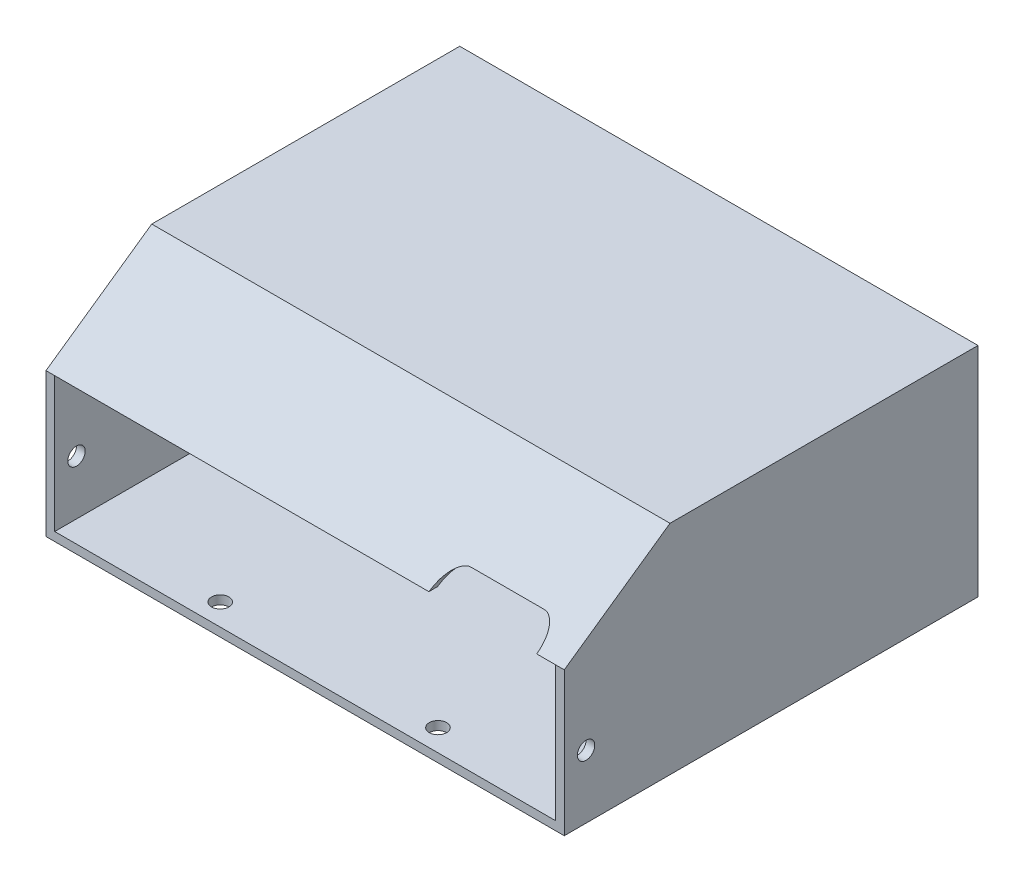
from build123d import *

# Parameters (mm, degrees)
SKETCH1_W               = 119
SKETCH1_H               = 50
BOSS_EXTRUDE1_DEPTH     = 95
SKETCH2_W               = 115
SKETCH2_H               = 46
CUT_EXTRUDE1_DEPTH      = 92
SKETCH3_W               = 50
SKETCH3_H               = 29
CUT_EXTRUDE2_DEPTH      = 10
SKETCH4_R               = 1.95
CUT_EXTRUDE3_DEPTH      = 10
SKETCH5_R               = 3.25
SKETCH5_R_2             = 1.95
BOSS_EXTRUDE3_DEPTH     = 10
FILLET1_R               = 2
SKETCH6_R               = 2
CUT_EXTRUDE4_DEPTH      = 10
CUT_EXTRUDE5_DEPTH      = 159.789168456
CUT_EXTRUDE5_DEPTH_BACK = 159.789168456
SKETCH8_R               = 2
BOSS_EXTRUDE4_DEPTH     = 115
CUT_EXTRUDE6_DEPTH      = 159.789168456
CUT_EXTRUDE6_DEPTH_BACK = 159.789168456
CUT_EXTRUDE8_DEPTH      = 10
CUT_EXTRUDE9_DEPTH      = 155.550962524


with BuildPart() as part:
    # Sketch1 → Boss-Extrude1 (new body)
    with BuildSketch(Plane.XY):
        with Locations((59.5, 25)):
            Rectangle(SKETCH1_W, SKETCH1_H)
    extrude(amount=BOSS_EXTRUDE1_DEPTH)

    # Sketch2 → Cut-Extrude1 (cut)
    with BuildSketch(Plane.XY.offset(95)):
        with Locations((59.5, 25)):
            Rectangle(SKETCH2_W, SKETCH2_H)
    extrude(amount=-CUT_EXTRUDE1_DEPTH, mode=Mode.SUBTRACT)

    # Sketch3 → Cut-Extrude2 (cut)
    with BuildSketch(Plane.XY.offset(3)):
        with Locations((33, 25)):
            Rectangle(SKETCH3_W, SKETCH3_H)
    extrude(amount=-CUT_EXTRUDE2_DEPTH, mode=Mode.SUBTRACT)

    # Sketch4 → Cut-Extrude3 (cut)
    with BuildSketch(Plane(origin=(0, 0, 0), x_dir=(-1, 0, 0), z_dir=(0, 0, -1))):
        with Locations((-32.95, 45)):
            Circle(SKETCH4_R)
        with Locations((-32.95, 5)):
            Circle(SKETCH4_R)
    extrude(amount=-CUT_EXTRUDE3_DEPTH, mode=Mode.SUBTRACT)

    # Sketch5 → Boss-Extrude3 (add)
    # profile 1 of 2: a face of its own
    with BuildSketch(Plane.XY.offset(3)):
        with Locations((32.95, 45)):
            Circle(SKETCH5_R)
        with Locations(Location((32.95, 45, 0), (0, 0, 180))):
            Circle(SKETCH5_R_2, mode=Mode.SUBTRACT)
    # profile 2 of 2: a face of its own
    with BuildSketch(Plane.XY.offset(3)):
        with Locations((32.95, 5)):
            Circle(SKETCH5_R)
        with Locations(Location((32.95, 5, 0), (0, 0, 180))):
            Circle(SKETCH5_R_2, mode=Mode.SUBTRACT)
    extrude(amount=BOSS_EXTRUDE3_DEPTH)

    # Fillet1
    fillet1_edges = [part.edges().sort_by_distance(p)[0] for p in [
        (31.147224362, 42.295836543, 3),
        (31.147224362, 7.704163457, 3),
    ]]
    fillet(fillet1_edges, radius=FILLET1_R)

    # Sketch6 → Cut-Extrude4 (cut)
    with BuildSketch(Plane(origin=(0, 2, 0), x_dir=(1, 0, 0), z_dir=(0, 1, 0))):
        with Locations(Location((85, -90, 0), (0, 0, 180))):
            Circle(SKETCH6_R)
        with Locations(Location((35, -90, 0), (0, 0, 180))):
            Circle(SKETCH6_R)
    extrude(amount=-CUT_EXTRUDE4_DEPTH, mode=Mode.SUBTRACT)

    # Sketch8 → Cut-Extrude5 (cut, two sides: drawn at the far end of the back side and taken through both)
    with BuildSketch(Plane(origin=(2, 0, 0), x_dir=(0, 0, -1), z_dir=(1, 0, 0)).offset(-CUT_EXTRUDE5_DEPTH_BACK)):
        with Locations(Location((-90, 14.5, 0), (0, 0, 90))):
            Circle(SKETCH8_R)
    extrude(amount=CUT_EXTRUDE5_DEPTH + CUT_EXTRUDE5_DEPTH_BACK, mode=Mode.SUBTRACT)

    # Sketch9 → Boss-Extrude4 (add)
    with BuildSketch(Plane(origin=(2, 0, 0), x_dir=(0, 0, -1), z_dir=(1, 0, 0))):
        Polygon((-95, 33), (-73.577779899, 48), (-71.577779899, 48), (-93, 33), align=None)
    extrude(amount=BOSS_EXTRUDE4_DEPTH)

    # Sketch10 → Cut-Extrude6 (cut, two sides: drawn at the far end of the back side and taken through both)
    with BuildSketch(Plane(origin=(2, 0, 0), x_dir=(0, 0, -1), z_dir=(1, 0, 0)).offset(-CUT_EXTRUDE6_DEPTH_BACK)):
        Polygon((-95, 33), (-95, 50), (-70.721483885, 50), align=None)
    extrude(amount=CUT_EXTRUDE6_DEPTH + CUT_EXTRUDE6_DEPTH_BACK, mode=Mode.SUBTRACT)

    # Sketch11 → Cut-Extrude8 (cut)
    with BuildSketch(Plane(origin=(0, 0, 0), x_dir=(-1, 0, 0), z_dir=(0, 0, -1))):
        with BuildLine():
            Line((-109.202811856, 45), (-109.202811856, 5))
            ThreePointArc((-109.202811856, 5), (-111, 3.202811856), (-112.797188144, 5))
            Line((-112.797188144, 5), (-112.797188144, 45))
            ThreePointArc((-112.797188144, 45), (-111, 46.797188144), (-109.202811856, 45))
        make_face()
        with BuildLine():
            Line((-102.202811856, 45), (-102.202811856, 5))
            ThreePointArc((-102.202811856, 5), (-104, 3.202811856), (-105.797188144, 5))
            Line((-105.797188144, 5), (-105.797188144, 45))
            ThreePointArc((-105.797188144, 45), (-104, 46.797188144), (-102.202811856, 45))
        make_face()
        with BuildLine():
            Line((-95.202811856, 45), (-95.202811856, 5))
            ThreePointArc((-95.202811856, 5), (-97, 3.202811856), (-98.797188144, 5))
            Line((-98.797188144, 5), (-98.797188144, 45))
            ThreePointArc((-98.797188144, 45), (-97, 46.797188144), (-95.202811856, 45))
        make_face()
        with BuildLine():
            Line((-88.202811856, 45), (-88.202811856, 5))
            ThreePointArc((-88.202811856, 5), (-90, 3.202811856), (-91.797188144, 5))
            Line((-91.797188144, 5), (-91.797188144, 45))
            ThreePointArc((-91.797188144, 45), (-90, 46.797188144), (-88.202811856, 45))
        make_face()
        with BuildLine():
            Line((-81.202811856, 45), (-81.202811856, 5))
            ThreePointArc((-81.202811856, 5), (-83, 3.202811856), (-84.797188144, 5))
            Line((-84.797188144, 5), (-84.797188144, 45))
            ThreePointArc((-84.797188144, 45), (-83, 46.797188144), (-81.202811856, 45))
        make_face()
        with BuildLine():
            Line((-74.202811856, 45), (-74.202811856, 5))
            ThreePointArc((-74.202811856, 5), (-76, 3.202811856), (-77.797188144, 5))
            Line((-77.797188144, 5), (-77.797188144, 45))
            ThreePointArc((-77.797188144, 45), (-76, 46.797188144), (-74.202811856, 45))
        make_face()
        with BuildLine():
            Line((-67.202811856, 45), (-67.202811856, 5))
            ThreePointArc((-67.202811856, 5), (-69, 3.202811856), (-70.797188144, 5))
            Line((-70.797188144, 5), (-70.797188144, 45))
            ThreePointArc((-70.797188144, 45), (-69, 46.797188144), (-67.202811856, 45))
        make_face()
    extrude(amount=-CUT_EXTRUDE8_DEPTH, mode=Mode.SUBTRACT)

    # Sketch12 → Cut-Extrude9 (cut, through all)
    with BuildSketch(Plane.XY.offset(10)):
        with BuildLine():
            Line((108.667383108, 29), (91.910743178, 29))
            ThreePointArc((91.910743178, 29), (87.910743178, 33), (91.910743178, 37))
            Line((91.910743178, 37), (108.667383108, 37))
            ThreePointArc((108.667383108, 37), (112.667383108, 33), (108.667383108, 29))
        make_face()
    extrude(amount=CUT_EXTRUDE9_DEPTH, mode=Mode.SUBTRACT)


solid = part.part
